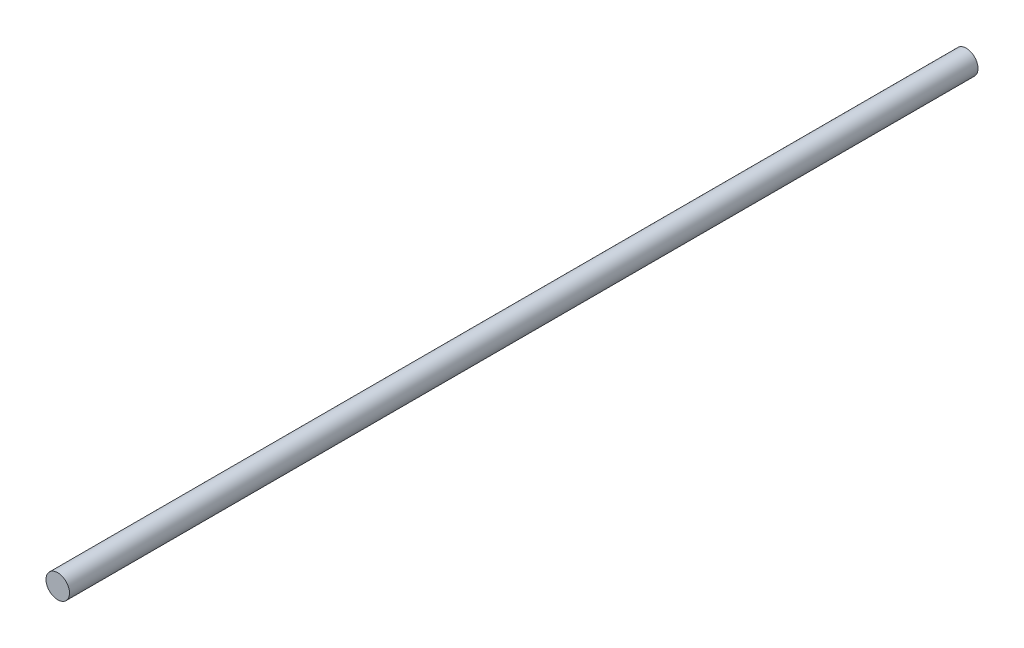
from build123d import *

# Parameters (mm, degrees)
SKETCH_1_R      = 3
EXTRUDE_1_DEPTH = 232


with BuildPart() as part:
    # 草图1 → 凸台-拉伸1 (new body)
    with BuildSketch(Plane.XY):
        with Locations(Location((0, 0, 0), (0, 0, 180))):
            Circle(SKETCH_1_R)
    extrude(amount=EXTRUDE_1_DEPTH)


solid = part.part
